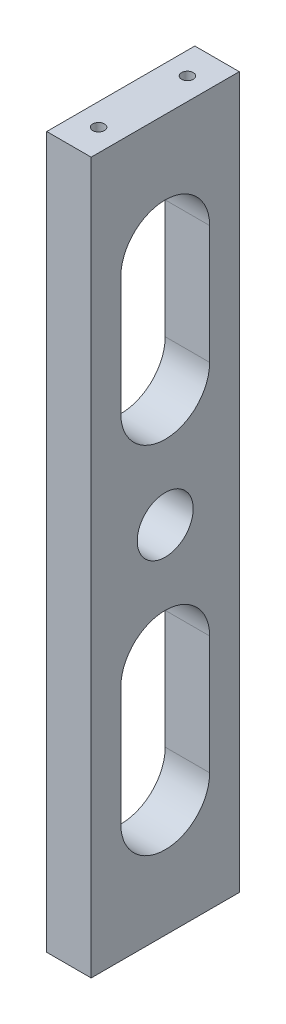
from build123d import *

# Parameters (mm, degrees)
SKETCH1_W                      = 31.75
SKETCH1_H                      = 152.4
BOSS_EXTRUDE1_DEPTH            = 4.7625
M3X0_5_TAPPED_HOLE1_AT_2_COUNT = 2
M3X0_5_TAPPED_HOLE1_AT_2_PITCH = 19.05
F_12_0MM_DOWEL_HOLE1_D         = 12
CUT_EXTRUDE1_DEPTH             = 79.416715374


with BuildPart() as part:
    # Sketch1 → Boss-Extrude1 (new, symmetric)
    with BuildSketch(Plane(origin=(0, 0, 0), x_dir=(0, 0, -1), z_dir=(1, 0, 0))):
        Rectangle(SKETCH1_W, SKETCH1_H)
    extrude(amount=BOSS_EXTRUDE1_DEPTH, both=True)

    # Sketch4 → M3x0.5 Tapped Hole1 (revolve, cut)
    with BuildSketch(Plane(origin=(0, 76.2, -9.525), x_dir=(0, 0, 1), z_dir=(1, 0, 0))):
        Polygon((0, 0), (0, 13.451075774), (1.25, 12.7), (1.25, 0), align=None)
    m3x0_5_tapped_hole1 = revolve(axis=Axis((0, 82.55, -9.525), (0, -1, 0)), mode=Mode.SUBTRACT)

    # M3x0.5 Tapped Hole1 at 2: M3x0.5 Tapped Hole1 ×2
    with Locations(*[(0, 0, i * M3X0_5_TAPPED_HOLE1_AT_2_PITCH) for i in range(1, M3X0_5_TAPPED_HOLE1_AT_2_COUNT)]):
        add(m3x0_5_tapped_hole1, mode=Mode.SUBTRACT)

    # Mirror1: M3x0.5 Tapped Hole1 across plane
    add(m3x0_5_tapped_hole1.mirror(Plane.ZX), mode=Mode.SUBTRACT)

    # Mirror1 copy 1 sketch → Mirror1 copy 1 (revolve, cut)
    with BuildSketch(Plane(origin=(0, -76.2, 9.525), x_dir=(0, 0, 1), z_dir=(1, 0, 0))):
        Polygon((0, 0), (0, -13.451075774), (1.25, -12.7), (1.25, 0), align=None)
    revolve(axis=Axis((0, -82.55, 9.525), (0, -1, 0)), mode=Mode.SUBTRACT)

    # Ø12.0mm Dowel Hole1 (through all)
    with Locations(Plane(origin=(4.7625, 0, 0), x_dir=(0, 0, -1), z_dir=(1, 0, 0))):
        with Locations((0, 0)):
            Hole(F_12_0MM_DOWEL_HOLE1_D / 2)

    # Sketch9 → Cut-Extrude1 (cut, through all)
    with BuildSketch(Plane(origin=(4.7625, 0, 0), x_dir=(0, 0, -1), z_dir=(1, 0, 0))):
        with BuildLine():
            Line((9.525, 50.8), (9.525, 25.4))
            ThreePointArc((9.525, 25.4), (0, 15.875), (-9.525, 25.4))
            Line((-9.525, 25.4), (-9.525, 50.8))
            ThreePointArc((-9.525, 50.8), (0, 60.325), (9.525, 50.8))
        make_face()
        with BuildLine():
            Line((9.525, -25.4), (9.525, -50.8))
            ThreePointArc((9.525, -50.8), (0, -60.325), (-9.525, -50.8))
            Line((-9.525, -50.8), (-9.525, -25.4))
            ThreePointArc((-9.525, -25.4), (0, -15.875), (9.525, -25.4))
        make_face()
    extrude(amount=-CUT_EXTRUDE1_DEPTH, mode=Mode.SUBTRACT)


solid = part.part
